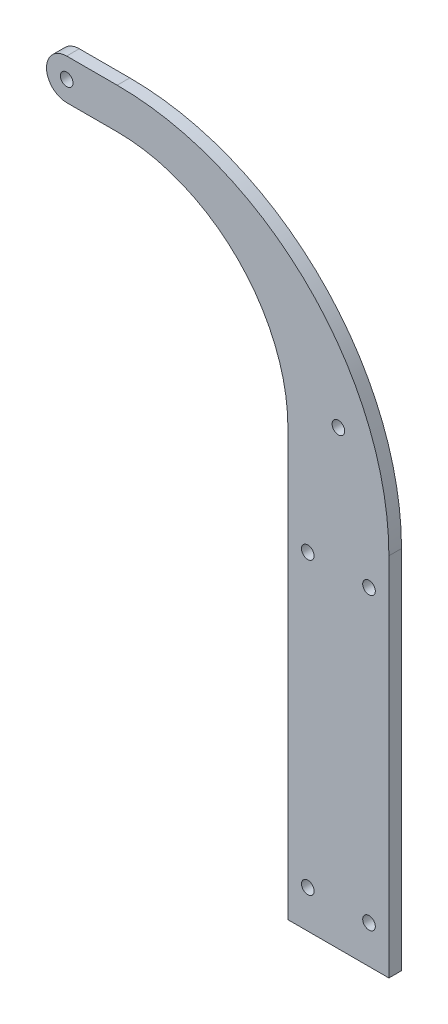
from build123d import *

# Parameters (mm, degrees)
SKETCH1_R           = 3.175
BOSS_EXTRUDE1_DEPTH = 6.35


with BuildPart() as part:
    # Sketch1 → Boss-Extrude1 (new body)
    with BuildSketch(Plane.XY):
        with BuildLine():
            Line((0, 10.16), (25.4, 10.16))
            ThreePointArc((25.4, 10.16), (122.061496988, -29.878503012), (162.1, -126.54))
            Line((162.1, -126.54), (162.1, -310.482187261))
            Line((162.1, -310.482187261), (111.3, -310.482187261))
            Line((111.3, -310.482187261), (111.3, -96.06))
            ThreePointArc((111.3, -96.06), (86.140472504, -35.319527496), (25.4, -10.16))
            Line((25.4, -10.16), (0, -10.16))
            ThreePointArc((0, -10.16), (-10.16, 0), (0, 10.16))
        make_face()
        Circle(SKETCH1_R, mode=Mode.SUBTRACT)
        with Locations((136.7, -83.36)):
            Circle(SKETCH1_R, mode=Mode.SUBTRACT)
        with Locations((121.3, -291.432187261)):
            Circle(SKETCH1_R, mode=Mode.SUBTRACT)
        with Locations((152.1, -291.432187261)):
            Circle(SKETCH1_R, mode=Mode.SUBTRACT)
        with Locations((121.3, -145.382187261)):
            Circle(SKETCH1_R, mode=Mode.SUBTRACT)
        with Locations((152.1, -145.382187261)):
            Circle(SKETCH1_R, mode=Mode.SUBTRACT)
    extrude(amount=BOSS_EXTRUDE1_DEPTH)


solid = part.part
